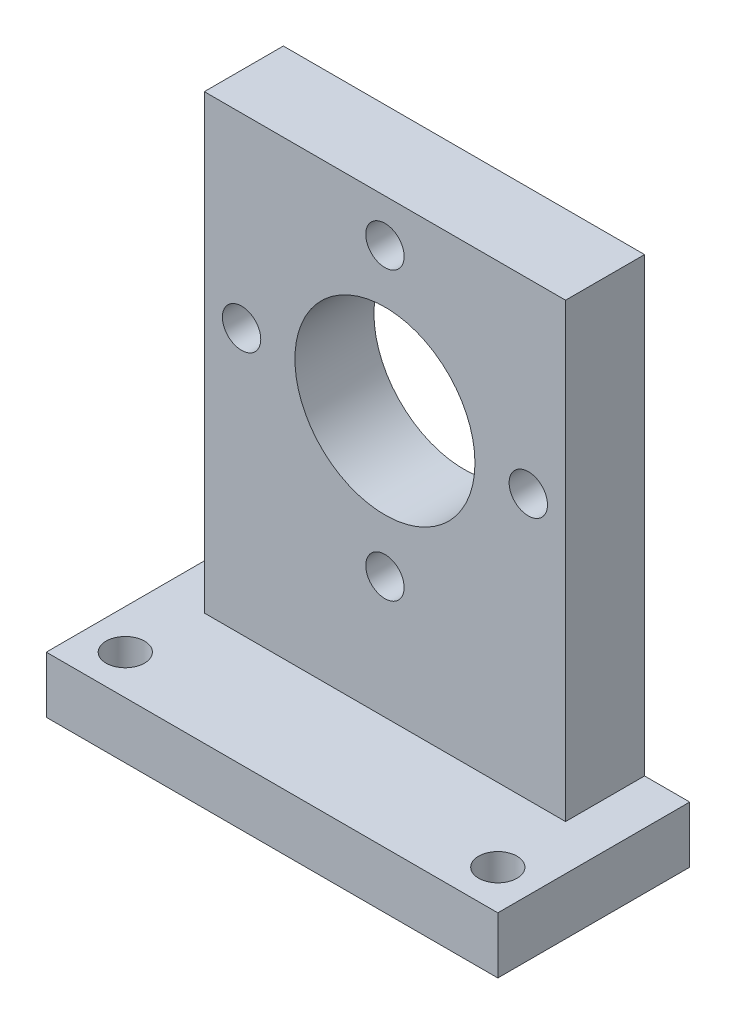
from build123d import *

# Parameters (mm, degrees)
SKETCH1_W           = 40
SKETCH1_H           = 27
SKETCH1_W_2         = 32
SKETCH1_H_2         = 7
BOSS_EXTRUDE1_DEPTH = 5
SKETCH1_3_W         = 32
SKETCH1_3_H         = 7
BOSS_EXTRUDE2_DEPTH = 45
CUT_EXTRUDE1_REACH  = 54.096
SKETCH2_R           = 7.9756
CUT_EXTRUDE2_REACH  = 54.096
SKETCH4_R           = 1.7
CUT_EXTRUDE3_REACH  = 48.715
SKETCH5_R           = 1.7
CUT_EXTRUDE5_REACH  = 48.715
SKETCH7_W           = 40
SKETCH7_H           = 10
SKETCH8_R           = 1.7
CUT_EXTRUDE6_DEPTH  = 6.35


with BuildPart() as part:
    # Sketch1 → Boss-Extrude1 (new body)
    with BuildSketch(Plane(origin=(0, 0, 0), x_dir=(1, 0, 0), z_dir=(0, 1, 0))):
        Rectangle(SKETCH1_W, SKETCH1_H)
        Rectangle(SKETCH1_W_2, SKETCH1_H_2, mode=Mode.SUBTRACT)
    extrude(amount=BOSS_EXTRUDE1_DEPTH)

    # Sketch1<3> → Boss-Extrude2 (add)
    with BuildSketch(Plane(origin=(0, 0, 0), x_dir=(1, 0, 0), z_dir=(0, 1, 0))):
        Rectangle(SKETCH1_3_W, SKETCH1_3_H)
    extrude(amount=BOSS_EXTRUDE2_DEPTH)

    # Sketch2 → Cut-Extrude1 (cut, up to next)
    with BuildSketch(Plane.XY.offset(3.5), mode=Mode.PRIVATE) as cut_extrude1_sk1:
        with Locations((0, 28.5)):
            Circle(SKETCH2_R)
    cut_extrude1_tool1 = extrude(cut_extrude1_sk1.sketch, amount=-CUT_EXTRUDE1_REACH, mode=Mode.PRIVATE) & part.part
    add(cut_extrude1_tool1.solids().sort_by_distance((0, 28.5, 3.5))[0], mode=Mode.SUBTRACT)

    # Sketch4 → Cut-Extrude2 (cut, up to next)
    with BuildSketch(Plane.XY.offset(3.5), mode=Mode.PRIVATE) as cut_extrude2_sk1:
        with Locations((0, 41.2)):
            Circle(SKETCH4_R)
    cut_extrude2_tool1 = extrude(cut_extrude2_sk1.sketch, amount=-CUT_EXTRUDE2_REACH, mode=Mode.PRIVATE) & part.part
    # Sketch4 → Cut-Extrude2 (cut, up to next)
    with BuildSketch(Plane.XY.offset(3.5), mode=Mode.PRIVATE) as cut_extrude2_sk2:
        with Locations((12.7, 28.5)):
            Circle(SKETCH4_R)
    cut_extrude2_tool2 = extrude(cut_extrude2_sk2.sketch, amount=-CUT_EXTRUDE2_REACH, mode=Mode.PRIVATE) & part.part
    # Sketch4 → Cut-Extrude2 (cut, up to next)
    with BuildSketch(Plane.XY.offset(3.5), mode=Mode.PRIVATE) as cut_extrude2_sk3:
        with Locations((0, 15.8)):
            Circle(SKETCH4_R)
    cut_extrude2_tool3 = extrude(cut_extrude2_sk3.sketch, amount=-CUT_EXTRUDE2_REACH, mode=Mode.PRIVATE) & part.part
    # Sketch4 → Cut-Extrude2 (cut, up to next)
    with BuildSketch(Plane.XY.offset(3.5), mode=Mode.PRIVATE) as cut_extrude2_sk4:
        with Locations((-12.7, 28.5)):
            Circle(SKETCH4_R)
    cut_extrude2_tool4 = extrude(cut_extrude2_sk4.sketch, amount=-CUT_EXTRUDE2_REACH, mode=Mode.PRIVATE) & part.part
    add(cut_extrude2_tool1.solids().sort_by_distance((0, 41.2, 3.5))[0], mode=Mode.SUBTRACT)
    add(cut_extrude2_tool2.solids().sort_by_distance((12.7, 28.5, 3.5))[0], mode=Mode.SUBTRACT)
    add(cut_extrude2_tool3.solids().sort_by_distance((0, 15.8, 3.5))[0], mode=Mode.SUBTRACT)
    add(cut_extrude2_tool4.solids().sort_by_distance((-12.7, 28.5, 3.5))[0], mode=Mode.SUBTRACT)

    # Sketch5 → Cut-Extrude3 (cut, up to next)
    with BuildSketch(Plane(origin=(0, 5, 0), x_dir=(1, 0, 0), z_dir=(0, 1, 0)), mode=Mode.PRIVATE) as cut_extrude3_sk1:
        with Locations((-16.5, 10)):
            Circle(SKETCH5_R)
    cut_extrude3_tool1 = extrude(cut_extrude3_sk1.sketch, amount=-CUT_EXTRUDE3_REACH, mode=Mode.PRIVATE) & part.part
    # Sketch5 → Cut-Extrude3 (cut, up to next)
    with BuildSketch(Plane(origin=(0, 5, 0), x_dir=(1, 0, 0), z_dir=(0, 1, 0)), mode=Mode.PRIVATE) as cut_extrude3_sk2:
        with Locations((-16.5, -10)):
            Circle(SKETCH5_R)
    cut_extrude3_tool2 = extrude(cut_extrude3_sk2.sketch, amount=-CUT_EXTRUDE3_REACH, mode=Mode.PRIVATE) & part.part
    # Sketch5 → Cut-Extrude3 (cut, up to next)
    with BuildSketch(Plane(origin=(0, 5, 0), x_dir=(1, 0, 0), z_dir=(0, 1, 0)), mode=Mode.PRIVATE) as cut_extrude3_sk3:
        with Locations((16.5, -10)):
            Circle(SKETCH5_R)
    cut_extrude3_tool3 = extrude(cut_extrude3_sk3.sketch, amount=-CUT_EXTRUDE3_REACH, mode=Mode.PRIVATE) & part.part
    # Sketch5 → Cut-Extrude3 (cut, up to next)
    with BuildSketch(Plane(origin=(0, 5, 0), x_dir=(1, 0, 0), z_dir=(0, 1, 0)), mode=Mode.PRIVATE) as cut_extrude3_sk4:
        with Locations((16.5, 10)):
            Circle(SKETCH5_R)
    cut_extrude3_tool4 = extrude(cut_extrude3_sk4.sketch, amount=-CUT_EXTRUDE3_REACH, mode=Mode.PRIVATE) & part.part
    add(cut_extrude3_tool1.solids().sort_by_distance((-16.5, 5, -10))[0], mode=Mode.SUBTRACT)
    add(cut_extrude3_tool2.solids().sort_by_distance((-16.5, 5, 10))[0], mode=Mode.SUBTRACT)
    add(cut_extrude3_tool3.solids().sort_by_distance((16.5, 5, 10))[0], mode=Mode.SUBTRACT)
    add(cut_extrude3_tool4.solids().sort_by_distance((16.5, 5, -10))[0], mode=Mode.SUBTRACT)

    # Sketch7 → Cut-Extrude5 (cut, up to next)
    with BuildSketch(Plane(origin=(0, 5, 0), x_dir=(1, 0, 0), z_dir=(0, 1, 0)), mode=Mode.PRIVATE) as cut_extrude5_sk1:
        with Locations((0, 8.5)):
            Rectangle(SKETCH7_W, SKETCH7_H)
    cut_extrude5_tool1 = extrude(cut_extrude5_sk1.sketch, amount=-CUT_EXTRUDE5_REACH, mode=Mode.PRIVATE) & part.part
    add(cut_extrude5_tool1.solids().sort_by_distance((0, 5, -8.5))[0], mode=Mode.SUBTRACT)

    # Sketch8 → Cut-Extrude6 (cut)
    with BuildSketch(Plane(origin=(0, 0, -3.5), x_dir=(-1, 0, 0), z_dir=(0, 0, -1))):
        with Locations((-12.7, 2.5)):
            Circle(SKETCH8_R)
        with Locations((12.7, 2.5)):
            Circle(SKETCH8_R)
    extrude(amount=-CUT_EXTRUDE6_DEPTH, mode=Mode.SUBTRACT)


solid = part.part
